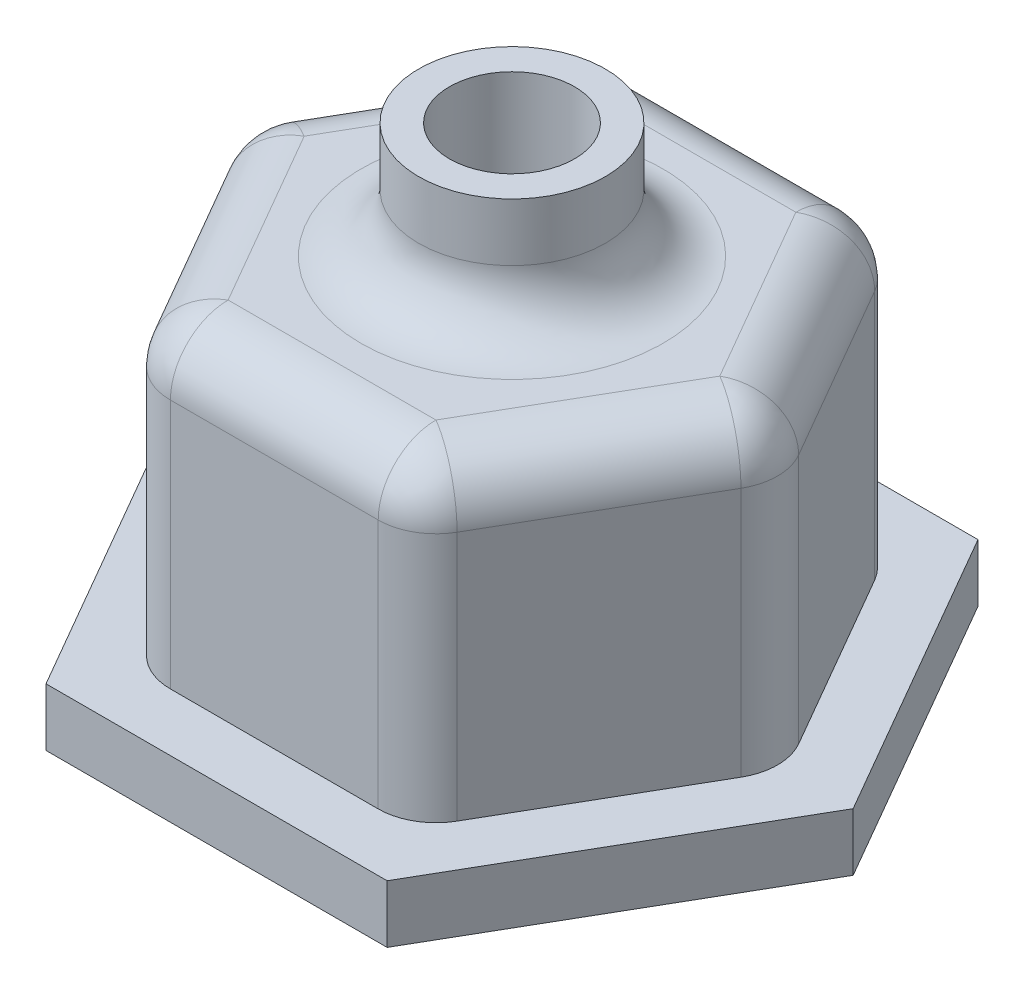
from build123d import *

# Parameters (mm, degrees)
BOSS_EXTRUDE1_DEPTH = 8
BOSS_EXTRUDE2_START = 1.5
BOSS_EXTRUDE2_DEPTH = 1.5
SKETCH4_R           = 2.425
SKETCH4_R_2         = 1.625
EXTRUDE_THIN1_DEPTH = 3
FILLET1_R           = 1.5


with BuildPart() as part:
    # Sketch1 → Boss-Extrude1 (new body)
    with BuildSketch(Plane(origin=(0, 0, 0), x_dir=(1, 0, 0), z_dir=(0, 1, 0))):
        Polygon((-7.130275824, 0), (-3.565137912, -6.175), (3.565137912, -6.175), (7.130275824, 0), (3.565137912, 6.175), (-3.565137912, 6.175), align=None)
        with BuildLine():
            Line((-1.15, 1.14809625), (-1.15, -1.14809625))
            ThreePointArc((-1.15, -1.14809625), (1.625, 0), (-1.15, 1.14809625))
        make_face(mode=Mode.SUBTRACT)
    extrude(amount=BOSS_EXTRUDE1_DEPTH)

    # Sketch2 → Boss-Extrude2 (add)
    with BuildSketch(Plane.XZ.offset(BOSS_EXTRUDE2_START)):
        Polygon((-4.431163316, 7.675), (-8.862326632, 0), (-4.431163316, -7.675), (4.431163316, -7.675), (8.862326632, 0), (4.431163316, 7.675), align=None)
        with BuildLine():
            Line((-1.15, -1.14809625), (-1.15, 1.14809625))
            ThreePointArc((-1.15, 1.14809625), (1.625, 0), (-1.15, -1.14809625))
        make_face(mode=Mode.SUBTRACT)
    extrude(amount=-BOSS_EXTRUDE2_DEPTH)

    # Sketch4 → Extrude-Thin1 (add)
    with BuildSketch(Plane(origin=(0, 8, 0), x_dir=(1, 0, 0), z_dir=(0, 1, 0))):
        Circle(SKETCH4_R)
        Circle(SKETCH4_R_2, mode=Mode.SUBTRACT)
    extrude(amount=EXTRUDE_THIN1_DEPTH)

    # Fillet1
    fillet1_edges = [part.edges().sort_by_distance(p)[0] for p in [
        (0, 8, 6.175),
        (-3.565137912, 4, -6.175),
        (3.565137912, 4, -6.175),
        (7.130275824, 4, 0),
        (3.565137912, 4, 6.175),
        (-3.565137912, 4, 6.175),
        (-7.130275824, 4, 0),
        (5.347706868, 8, 3.0875),
        (5.347706868, 8, -3.0875),
        (0, 8, -6.175),
        (-5.347706868, 8, -3.0875),
        (-2.425, 8, 0),
        (-5.347706868, 8, 3.0875),
    ]]
    fillet(fillet1_edges, radius=FILLET1_R)


solid = part.part
